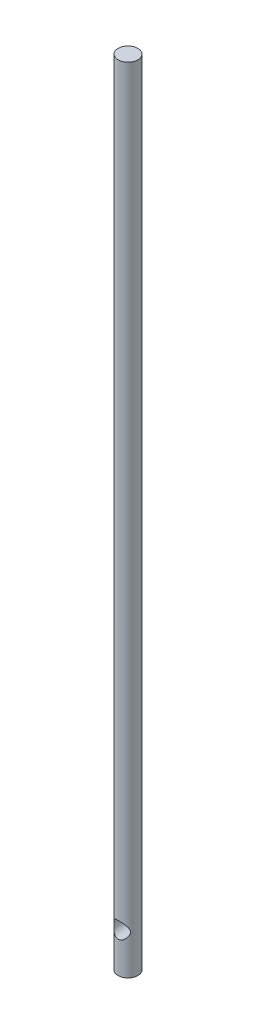
from build123d import *

# Parameters (mm, degrees)
SKETCH1_R               = 3.175
BOSS_EXTRUDE1_DEPTH     = 254
CUT_EXTRUDE1_DEPTH      = 254
CUT_EXTRUDE1_DEPTH_BACK = 254
SKETCH2_R               = 2.6035


with BuildPart() as part:
    # Sketch1 → Boss-Extrude1 (new body)
    with BuildSketch(Plane(origin=(0, 0, 0), x_dir=(1, 0, 0), z_dir=(0, 1, 0))):
        Circle(SKETCH1_R)
    extrude(amount=BOSS_EXTRUDE1_DEPTH)

    # Sketch2 → Cut-Extrude1 (cut, two sides: drawn at the far end of the back side and taken through both)
    with BuildSketch(Plane.XY.offset(-CUT_EXTRUDE1_DEPTH_BACK)):
        with Locations((0, 12.7)):
            Circle(SKETCH2_R)
    extrude(amount=CUT_EXTRUDE1_DEPTH + CUT_EXTRUDE1_DEPTH_BACK, mode=Mode.SUBTRACT)


solid = part.part
